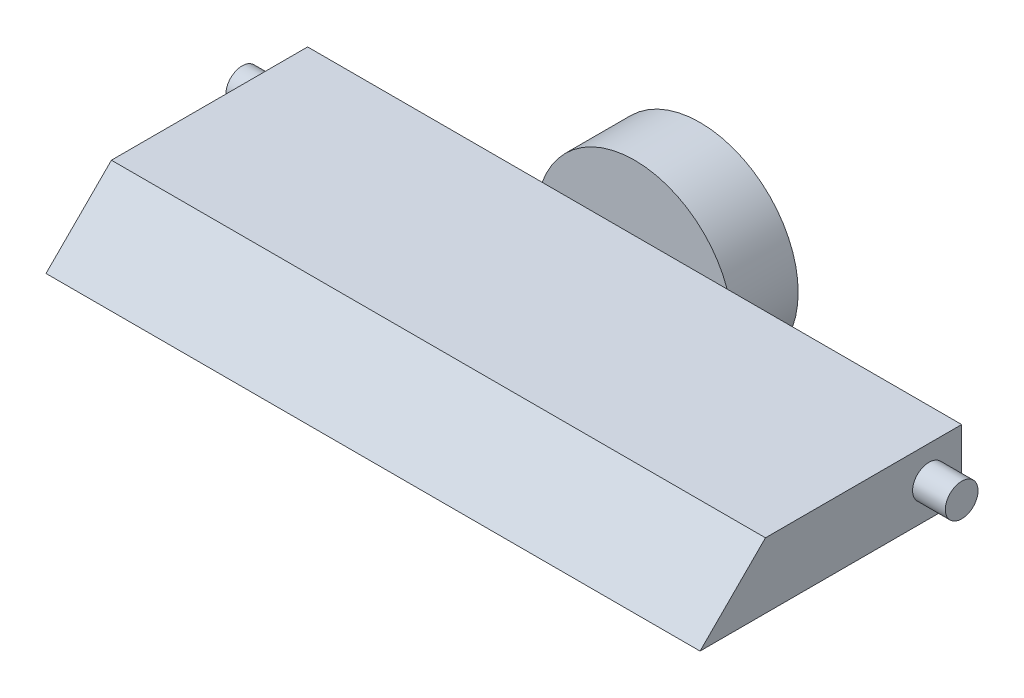
from build123d import *

# Parameters (mm, degrees)
BOSS_EXTRUDE1_DEPTH      = 4
BOSS_EXTRUDE1_DEPTH_BACK = 4
SKETCH2_W                = 20
SKETCH2_H                = 2
CUT_EXTRUDE1_DEPTH       = 20
SKETCH5_R                = 0.5
BOSS_EXTRUDE3_DEPTH      = 1
SKETCH8_R                = 3
BOSS_EXTRUDE5_DEPTH      = 2


with BuildPart() as part:
    # Sketch2 → Boss-Extrude1 (new, two sides: drawn at the far end of the back side and taken through both)
    with BuildSketch(Plane.XY.offset(-146.611129216).offset(-BOSS_EXTRUDE1_DEPTH_BACK)):
        with Locations((-43.541013266, -149.954890484)):
            Rectangle(SKETCH2_W, SKETCH2_H)
    extrude(amount=BOSS_EXTRUDE1_DEPTH + BOSS_EXTRUDE1_DEPTH_BACK)

    # Sketch4 → Cut-Extrude1 (cut)
    with BuildSketch(Plane.ZY.offset(53.541013266)):
        Polygon((-142.611129216, -148.954890484), (-142.611129216, -150.954890484), (-144.611129216, -148.954890484), align=None)
    extrude(amount=-CUT_EXTRUDE1_DEPTH, mode=Mode.SUBTRACT)

    # Sketch5 → Boss-Extrude3 (add)
    with BuildSketch(Plane.ZY.offset(53.541013266)):
        with Locations((-149.611129216, -149.954890484)):
            Circle(SKETCH5_R)
    boss_extrude3 = extrude(amount=BOSS_EXTRUDE3_DEPTH)

    # Mirror2: Boss-Extrude3 across plane
    add(boss_extrude3.mirror(Plane.ZY.offset(43.541013266)))

    # Sketch8 → Boss-Extrude5 (add)
    with BuildSketch(Plane(origin=(0, 0, -150.611129216), x_dir=(-1, 0, 0), z_dir=(0, 0, -1))):
        with Locations(Location((43.541013266, -149.954890484, 0), (0, 0, 199.471220634))):
            Circle(SKETCH8_R)
    extrude(amount=BOSS_EXTRUDE5_DEPTH)


solid = part.part
